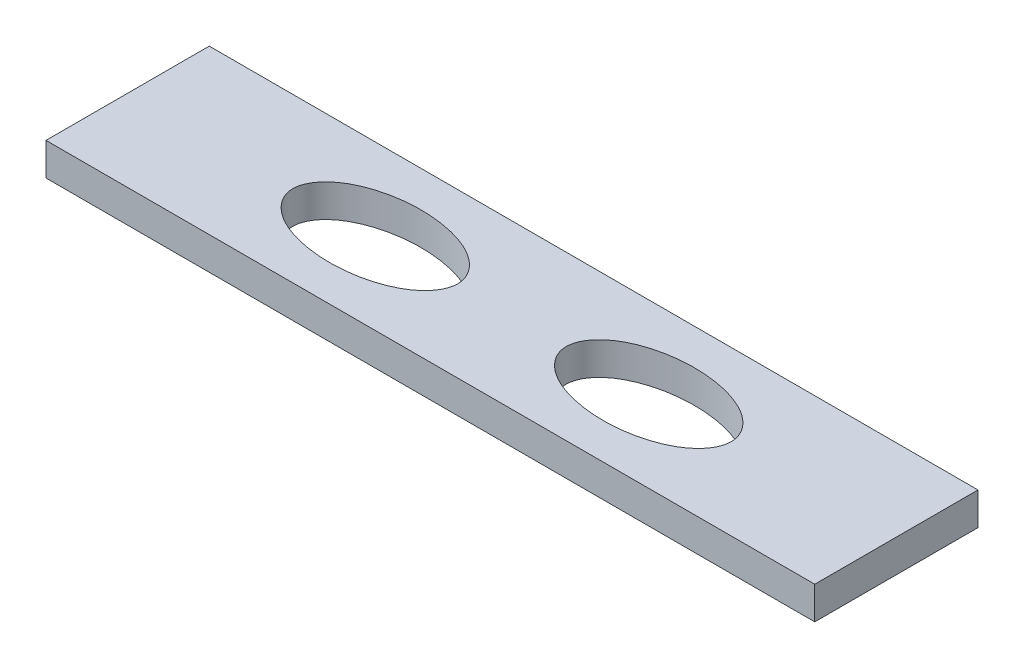
from build123d import *

# Parameters (mm, degrees)
SKETCH1_W           = 47.09
SKETCH1_H           = 10
BOSS_EXTRUDE1_DEPTH = 2


with BuildPart() as part:
    # Sketch1 → Boss-Extrude1 (new body)
    with BuildSketch(Plane(origin=(0, 0, 0), x_dir=(1, 0, 0), z_dir=(0, 1, 0))):
        with Locations((-13.079545455, 1.78030303)):
            Rectangle(SKETCH1_W, SKETCH1_H)
        with BuildLine():
            add(Edge.make_bspline(
                [(-9.754545455, 1.78030303), (-9.754545455, 1.044100491), (-8.642482329, -0.428304587), (-4.704545455, -1.315393161), (-0.76660858, -0.428304587), (0.901486108, 1.78030303), (-0.76660858, 3.988910648), (-4.704545455, 4.875999221), (-8.642482329, 3.988910648), (-9.754545455, 2.51650557), (-9.754545455, 1.78030303)],
                knots=[0, 0, 0, 0, 0.785398163, 1.570796327, 2.35619449, 3.141592654, 3.926990817, 4.71238898, 5.497787144, 6.283185307, 6.283185307, 6.283185307, 6.283185307], degree=3))
        make_face(mode=Mode.SUBTRACT)
        with BuildLine():
            add(Edge.make_bspline(
                [(-16.404545455, 1.78030303), (-16.404545455, 1.044100491), (-17.51660858, -0.428304587), (-21.454545455, -1.315393161), (-25.392482329, -0.428304587), (-27.060577017, 1.78030303), (-25.392482329, 3.988910648), (-21.454545455, 4.875999221), (-17.51660858, 3.988910648), (-16.404545455, 2.51650557), (-16.404545455, 1.78030303)],
                knots=[0, 0, 0, 0, 0.785398163, 1.570796327, 2.35619449, 3.141592654, 3.926990817, 4.71238898, 5.497787144, 6.283185307, 6.283185307, 6.283185307, 6.283185307], degree=3))
        make_face(mode=Mode.SUBTRACT)
    extrude(amount=BOSS_EXTRUDE1_DEPTH)


solid = part.part
